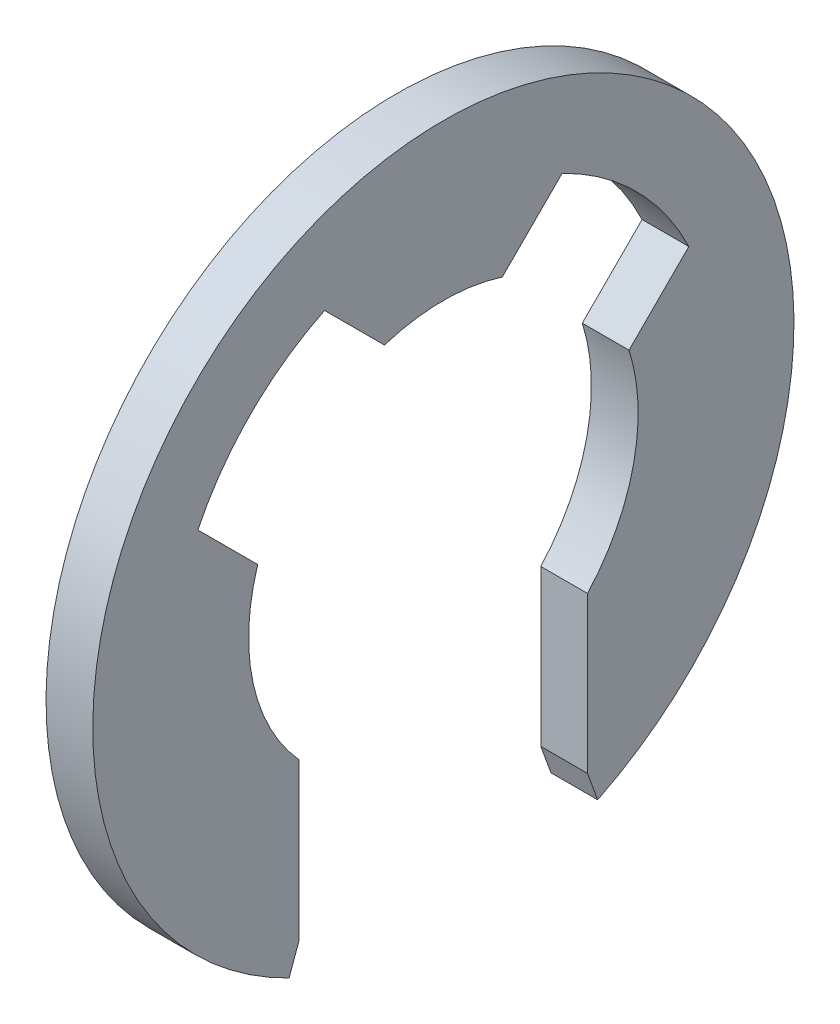
from build123d import *

# Parameters (mm, degrees)
ESQUISSE1_R             = 4.5
BASE_EXTRUSION_DEPTH    = 0.6
ENL_V_MAT_EXTRU_1_DEPTH = 7.392182726


with BuildPart() as part:
    # Esquisse1 → Base-Extrusion (new body)
    with BuildSketch(Plane(origin=(0, 0, 0), x_dir=(0, 0, -1), z_dir=(1, 0, 0))):
        Circle(ESQUISSE1_R)
    extrude(amount=BASE_EXTRUSION_DEPTH)

    # Esquisse2 → Enlèv. mat.-Extru.1 (cut, through all)
    with BuildSketch(Plane(origin=(0.6, 0, 0), x_dir=(0, 0, -1), z_dir=(1, 0, 0))):
        with BuildLine():
            Line((0.756460917, 2.382806514), (1.524293779, 3.150639376))
            ThreePointArc((1.524293779, 3.150639376), (2.474873734, 2.474873734), (3.150639376, 1.524293779))
            Line((3.150639376, 1.524293779), (2.382806514, 0.756460917))
            ThreePointArc((2.382806514, 0.756460917), (2.442354814, -0.533763022), (1.85, -1.681517172))
            Line((1.85, -1.681517172), (1.85, -3.681517172))
            Line((1.85, -3.681517172), (1.980710639, -4.040641702))
            ThreePointArc((1.980710639, -4.040641702), (0, -4.5), (-1.980710639, -4.040641702))
            Line((-1.980710639, -4.040641702), (-1.85, -3.681517172))
            Line((-1.85, -3.681517172), (-1.85, -1.681517172))
            ThreePointArc((-1.85, -1.681517172), (-2.442354814, -0.533763022), (-2.382806514, 0.756460917))
            Line((-2.382806514, 0.756460917), (-3.150639376, 1.524293779))
            ThreePointArc((-3.150639376, 1.524293779), (-2.474873734, 2.474873734), (-1.524293779, 3.150639376))
            Line((-1.524293779, 3.150639376), (-0.756460917, 2.382806514))
            ThreePointArc((-0.756460917, 2.382806514), (0, 2.5), (0.756460917, 2.382806514))
        make_face()
    extrude(amount=-ENL_V_MAT_EXTRU_1_DEPTH, mode=Mode.SUBTRACT)


solid = part.part
